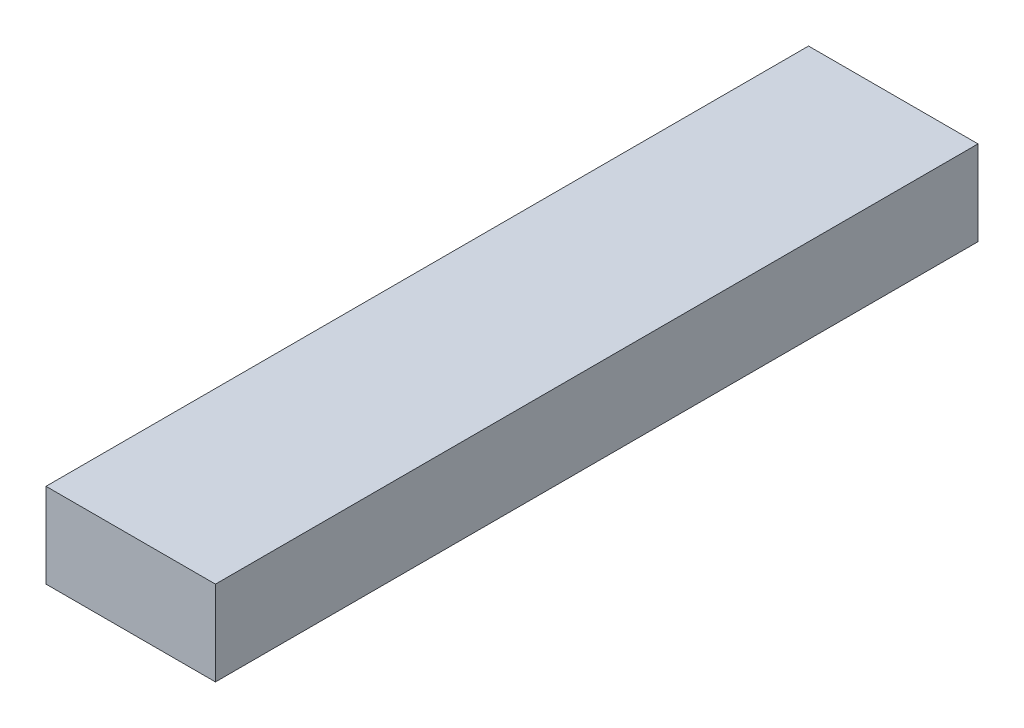
from build123d import *

# Parameters (mm, degrees)
SKETCH1_W           = 50.8
SKETCH1_H           = 25.4
BOSS_EXTRUDE1_DEPTH = 228.6


with BuildPart() as part:
    # Sketch1 → Boss-Extrude1 (new body)
    with BuildSketch(Plane.XY):
        Rectangle(SKETCH1_W, SKETCH1_H)
    extrude(amount=BOSS_EXTRUDE1_DEPTH)


solid = part.part
